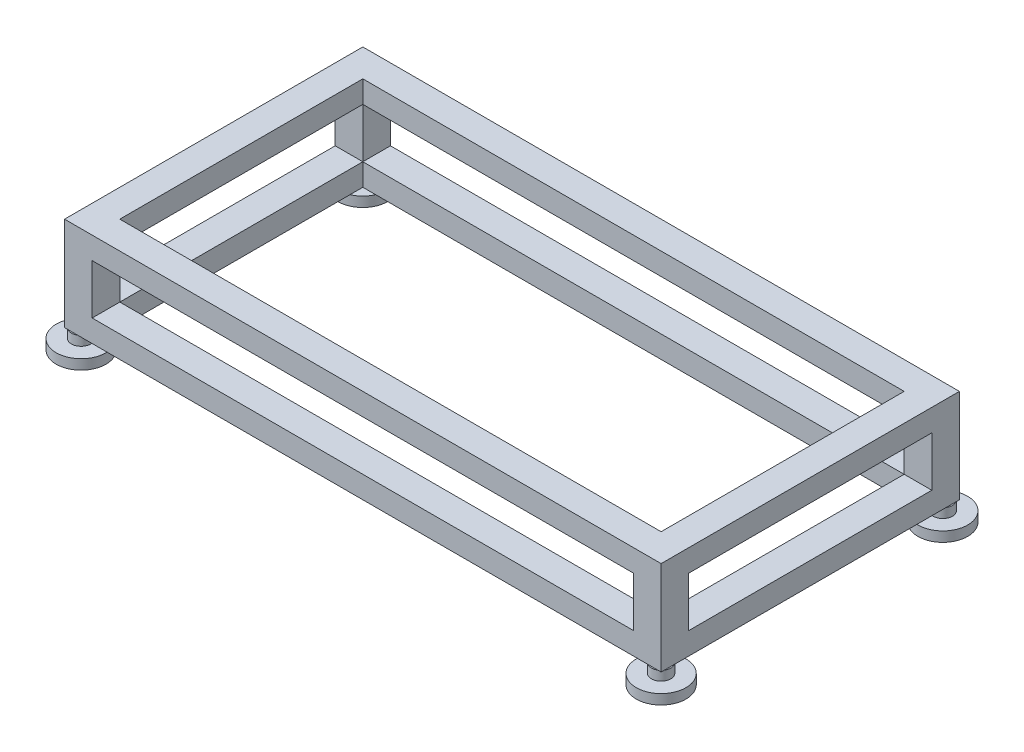
from build123d import *

# Parameters (mm, degrees)
SKETCH_1_W             = 1080
SKETCH_1_H             = 540
SKETCH_1_W_2           = 980
SKETCH_1_H_2           = 440
EXTRUDE_1_DEPTH        = 170
SKETCH_2_W             = 980
SKETCH_2_H             = 90
CUT_EXTRUDE_1_DEPTH    = 825.924238946
SKETCH_3_W             = 440
SKETCH_3_H             = 90
CUT_EXTRUDE_2_DEPTH    = 1127.143862923
FOUR_START             = -187
SKETCH_6_R             = 45
FOUR_BASE_PADS_DEPTH   = 18
FOUR_BASE_PADS_2_DEPTH = 18
FOUR_BASE_PADS_3_DEPTH = 18
FOUR_BASE_PADS_4_DEPTH = 18
FOUR_START_2           = -170
SKETCH_7_R             = 17.5
FOUR_FOOT_STEMS_DEPTH  = 17


with BuildPart() as part:
    # 草图1 → 拉伸-薄壁1 (new body)
    with BuildSketch(Plane(origin=(0, 0, 0), x_dir=(1, 0, 0), z_dir=(0, 1, 0))):
        with Locations((60, 0)):
            Rectangle(SKETCH_1_W, SKETCH_1_H)
        with Locations((60, 0)):
            Rectangle(SKETCH_1_W_2, SKETCH_1_H_2, mode=Mode.SUBTRACT)
    extrude(amount=-EXTRUDE_1_DEPTH)

    # 草图2 → 切除-拉伸1 (cut, through all)
    with BuildSketch(Plane.XY.offset(270)):
        with Locations((60, -85)):
            Rectangle(SKETCH_2_W, SKETCH_2_H)
    extrude(amount=-CUT_EXTRUDE_1_DEPTH, mode=Mode.SUBTRACT)

    # 草图3 → 切除-拉伸2 (cut, through all)
    with BuildSketch(Plane.ZY.offset(480)):
        with Locations((0, -85)):
            Rectangle(SKETCH_3_W, SKETCH_3_H)
    extrude(amount=-CUT_EXTRUDE_2_DEPTH, mode=Mode.SUBTRACT)



with BuildPart() as body_2:
    # 草图6 → Four Base Pads (new body)
    with BuildSketch(Plane(origin=(0, 0, 0), x_dir=(1, 0, 0), z_dir=(0, 1, 0)).offset(FOUR_START)):
        with Locations(Location((-465, -255, 0), (0, 0, 270))):
            Circle(SKETCH_6_R)
    extrude(amount=-FOUR_BASE_PADS_DEPTH)


with BuildPart() as body_3:
    # 草图6 → Four Base Pads 2 (new body)
    with BuildSketch(Plane(origin=(0, 0, 0), x_dir=(1, 0, 0), z_dir=(0, 1, 0)).offset(FOUR_START)):
        with Locations(Location((-465, 255, 0), (0, 0, 270))):
            Circle(SKETCH_6_R)
    extrude(amount=-FOUR_BASE_PADS_2_DEPTH)


with BuildPart() as body_4:
    # 草图6 → Four Base Pads 3 (new body)
    with BuildSketch(Plane(origin=(0, 0, 0), x_dir=(1, 0, 0), z_dir=(0, 1, 0)).offset(FOUR_START)):
        with Locations(Location((585, -255, 0), (0, 0, 270))):
            Circle(SKETCH_6_R)
    extrude(amount=-FOUR_BASE_PADS_3_DEPTH)


with BuildPart() as body_5:
    # 草图6 → Four Base Pads 4 (new body)
    with BuildSketch(Plane(origin=(0, 0, 0), x_dir=(1, 0, 0), z_dir=(0, 1, 0)).offset(FOUR_START)):
        with Locations(Location((585, 255, 0), (0, 0, 270))):
            Circle(SKETCH_6_R)
    extrude(amount=-FOUR_BASE_PADS_4_DEPTH)


with BuildPart() as part_1:
    add(part.part)

    add(body_2.part)  # Four Foot Stems merges body 2

    add(body_3.part)  # Four Foot Stems merges body 3

    add(body_4.part)  # Four Foot Stems merges body 4

    add(body_5.part)  # Four Foot Stems merges body 5
    # 草图7 → Four Foot Stems (add)
    with BuildSketch(Plane(origin=(0, 0, 0), x_dir=(1, 0, 0), z_dir=(0, 1, 0)).offset(FOUR_START_2)):
        with Locations(Location((-465, -255, 0), (0, 0, 270))):
            Circle(SKETCH_7_R)
        with Locations(Location((-465, 255, 0), (0, 0, 270))):
            Circle(SKETCH_7_R)
        with Locations(Location((585, -255, 0), (0, 0, 270))):
            Circle(SKETCH_7_R)
        with Locations(Location((585, 255, 0), (0, 0, 270))):
            Circle(SKETCH_7_R)
    extrude(amount=-FOUR_FOOT_STEMS_DEPTH)


solid = part_1.part
